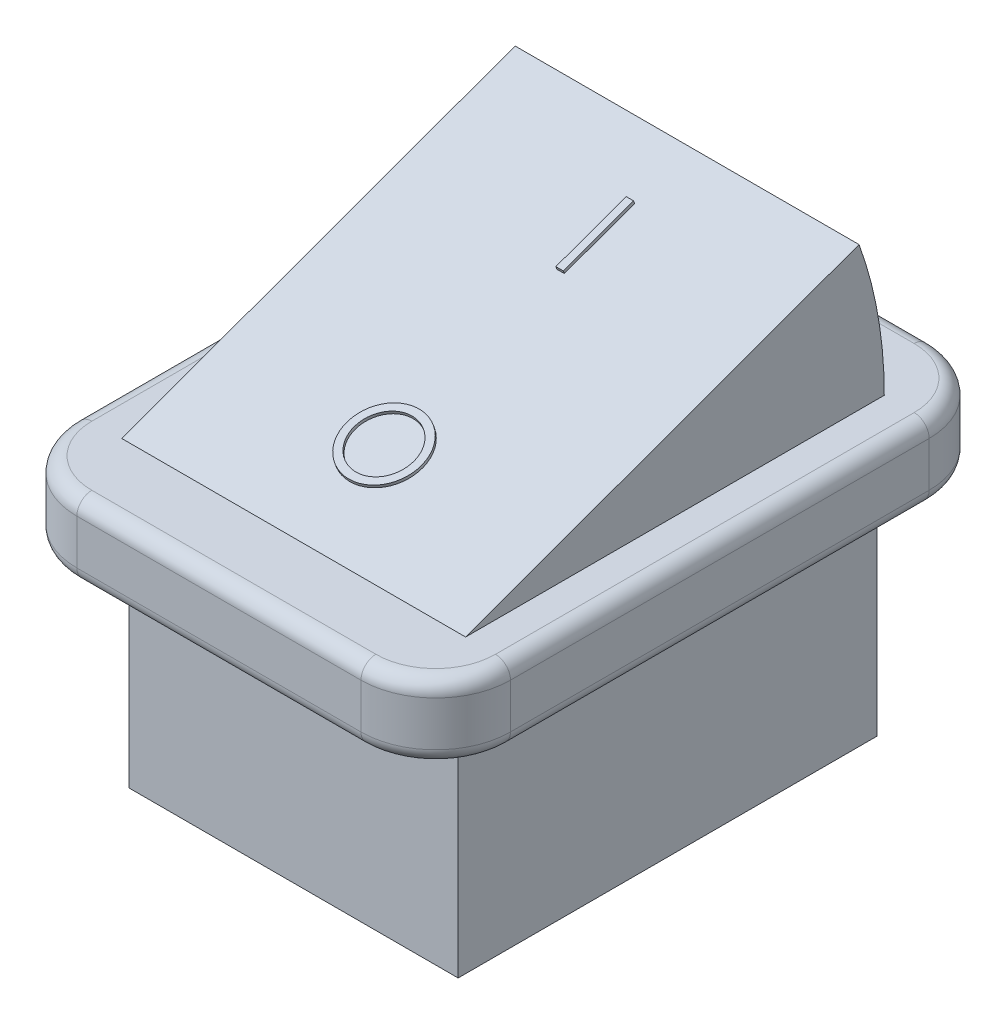
from build123d import *

# Parameters (mm, degrees)
SKETCH_1_W      = 22
SKETCH_1_H      = 28
EXTRUDE_2_DEPTH = 15
SKETCH_1_5_W    = 29
SKETCH_1_5_H    = 38
EXTRUDE_3_DEPTH = 5
SKETCH_2_W      = 23
SKETCH_2_H      = 28
REVOLVE_1_ANGLE = 20
SKETCH_3_R      = 2.5
SKETCH_3_R_2    = 2
EXTRUDE_4_DEPTH = 0.2
FILLET_1_R      = 5
FILLET_2_R      = 1


with BuildPart() as part:
    # 草图1 → 凸台-拉伸2 (new body)
    with BuildSketch(Plane(origin=(0, 0, 0), x_dir=(1, 0, 0), z_dir=(0, 1, 0))):
        Rectangle(SKETCH_1_W, SKETCH_1_H)
    extrude(amount=-EXTRUDE_2_DEPTH)

    # 草图1<5> → 凸台-拉伸3 (add)
    with BuildSketch(Plane(origin=(0, 0, 0), x_dir=(1, 0, 0), z_dir=(0, 1, 0))):
        Rectangle(SKETCH_1_5_W, SKETCH_1_5_H)
    extrude(amount=EXTRUDE_3_DEPTH)

    # 草图2 → 旋转1 (revolve)
    with BuildSketch(Plane(origin=(0, 5, 0), x_dir=(1, 0, 0), z_dir=(0, 1, 0))):
        Rectangle(SKETCH_2_W, SKETCH_2_H)
    revolve(axis=Axis((-11.5, 5, 14), (1, 0, 0)), revolution_arc=REVOLVE_1_ANGLE)

    # 草图3 → 凸台-拉伸4 (add)
    # profile 1 of 2: a face of its own
    with BuildSketch(Plane(origin=(0, 8.914624376, 3.244657922), x_dir=(1, 0, 0), z_dir=(0, 0.9396926207859082, 0.34202014332566943))):
        with Locations((0, -4.945595974)):
            Circle(SKETCH_3_R)
        with Locations((0, -4.945595974)):
            Circle(SKETCH_3_R_2, mode=Mode.SUBTRACT)
    # profile 2 of 2: a face of its own
    with BuildSketch(Plane(origin=(0, 8.914624376, 3.244657922), x_dir=(1, 0, 0), z_dir=(0, 0.9396926207859082, 0.34202014332566943))):
        Polygon((-0.25, 7.554404026), (0, 7.554404026), (0.25, 7.554404026), (0.25, 12.554404026), (-0.25, 12.554404026), align=None)
    extrude(amount=EXTRUDE_4_DEPTH)

    # 圆角1
    fillet_1_edges = [part.edges().sort_by_distance(p)[0] for p in [
        (-14.5, 2.5, -19),
        (14.5, 2.5, -19),
        (14.5, 2.5, 19),
        (-14.5, 2.5, 19),
    ]]
    fillet(fillet_1_edges, radius=FILLET_1_R)

    # 圆角2
    fillet_2_edges = [part.edges().sort_by_distance(p)[0] for p in [
        (13.035533906, 0, -17.535533906),
        (0, 0, -19),
        (-13.035533906, 0, -17.535533906),
        (-14.5, 0, 0),
        (-13.035533906, 0, 17.535533906),
        (0, 0, 19),
        (13.035533906, 0, 17.535533906),
        (13.035533906, 5, -17.535533906),
        (0, 5, -19),
        (-13.035533906, 5, -17.535533906),
        (-14.5, 5, 0),
        (-13.035533906, 5, 17.535533906),
        (0, 5, 19),
        (13.035533906, 5, 17.535533906),
        (14.5, 0, 0),
        (14.5, 5, 0),
    ]]
    fillet(fillet_2_edges, radius=FILLET_2_R)


solid = part.part
